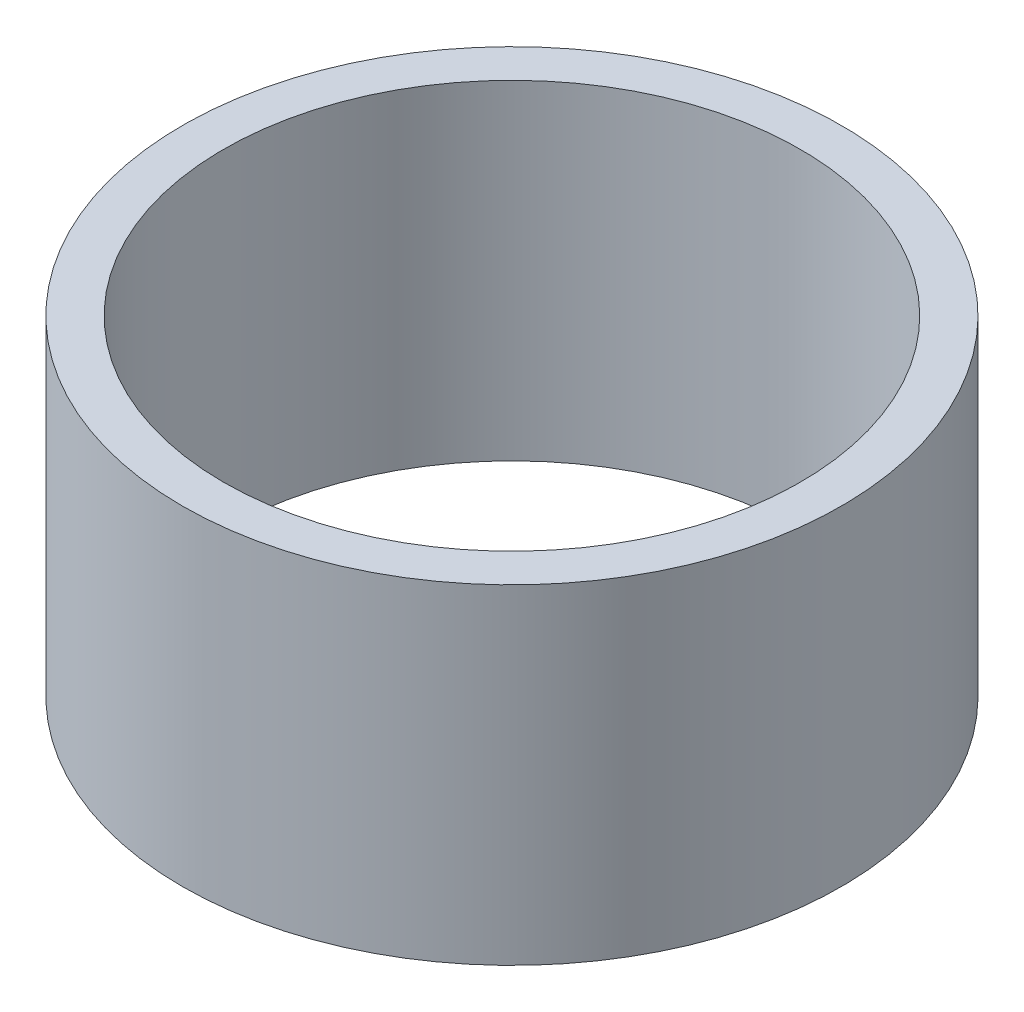
from build123d import *

# Parameters (mm, degrees)
SKETCH1_R           = 2
SKETCH1_R_2         = 1.75
BOSS_EXTRUDE1_DEPTH = 2


with BuildPart() as part:
    # Sketch1 → Boss-Extrude1 (new body)
    with BuildSketch(Plane(origin=(0, 0, 0), x_dir=(1, 0, 0), z_dir=(0, 1, 0))):
        with Locations(Location((0, 0, 0), (0, 0, 270))):
            Circle(SKETCH1_R)
        with Locations(Location((0, 0, 0), (0, 0, 270))):
            Circle(SKETCH1_R_2, mode=Mode.SUBTRACT)
    extrude(amount=BOSS_EXTRUDE1_DEPTH)


solid = part.part
